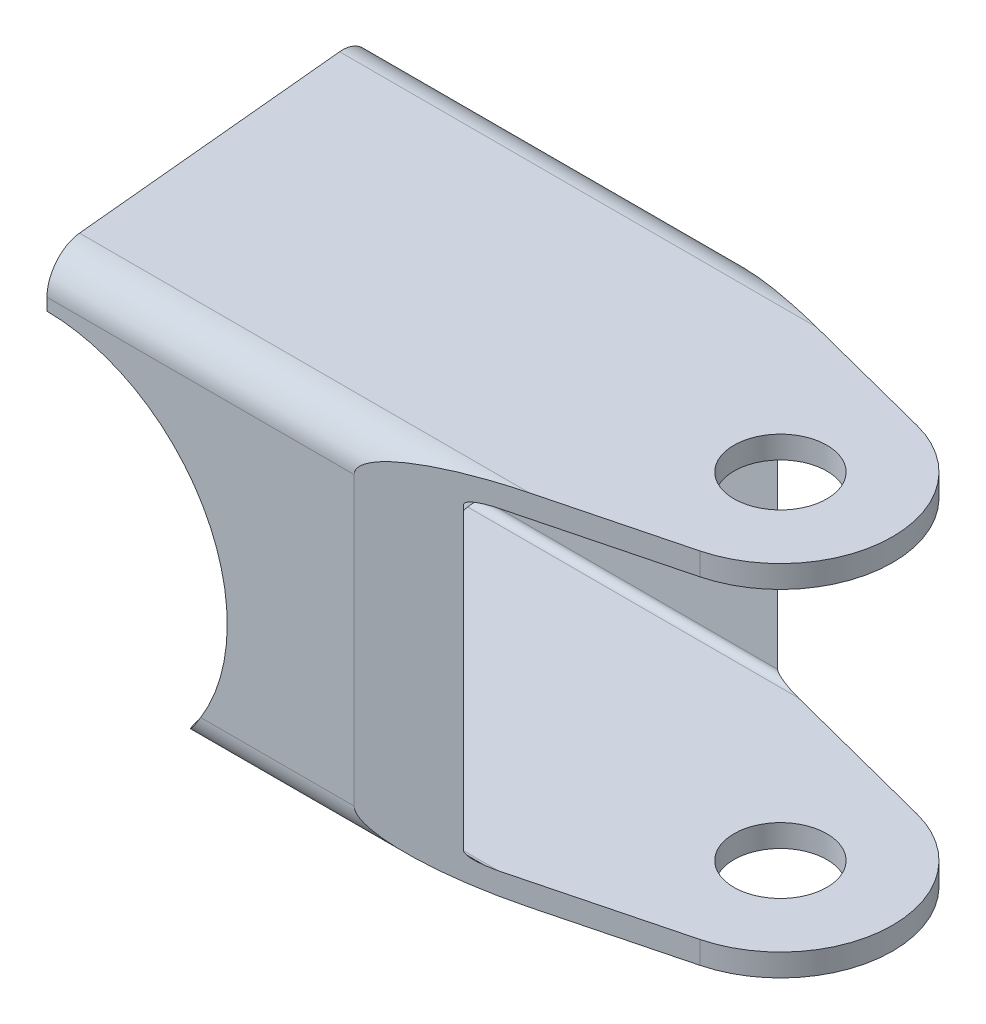
from build123d import *

# Parameters (mm, degrees)
BOSS_EXTRUDE1_DEPTH      = 25.4
BOSS_EXTRUDE1_DEPTH_BACK = 34.925
CUT_EXTRUDE4_DEPTH       = 63.941922635
CUT_EXTRUDE5_DEPTH       = 46.01339384
SKETCH14_R               = 3.2893
CUT_EXTRUDE6_DEPTH       = 46.01339384
CUT_EXTRUDE7_DEPTH       = 56.927898629
CUT_EXTRUDE7_DEPTH_BACK  = 56.927898629
SKETCH15_R               = 12.7
SKETCH17_W               = 59.080455772
SKETCH17_H               = 55.148842709
CUT_EXTRUDE8_DEPTH       = 52.94853237


with BuildPart() as part:
    # Sketch1 → Boss-Extrude1 (new, two sides: drawn at the far end of the back side and taken through both)
    with BuildSketch(Plane(origin=(0, 0, 0), x_dir=(0, 0, -1), z_dir=(1, 0, 0)).offset(-BOSS_EXTRUDE1_DEPTH_BACK)):
        with BuildLine():
            Line((-10.16, 12.7), (10.16, 12.7))
            ThreePointArc((10.16, 12.7), (11.956051224, 11.956051224), (12.7, 10.16))
            Line((12.7, 10.16), (12.7, -10.16))
            ThreePointArc((12.7, -10.16), (11.956051224, -11.956051224), (10.16, -12.7))
            Line((10.16, -12.7), (-10.16, -12.7))
            ThreePointArc((-10.16, -12.7), (-11.956051224, -11.956051224), (-12.7, -10.16))
            Line((-12.7, -10.16), (-12.7, 10.16))
            ThreePointArc((-12.7, 10.16), (-11.956051224, 11.956051224), (-10.16, 12.7))
        make_face()
    extrude(amount=BOSS_EXTRUDE1_DEPTH + BOSS_EXTRUDE1_DEPTH_BACK)

    # Sketch11 → Cut-Extrude4 (cut, through all)
    with BuildSketch(Plane(origin=(25.4, 0, 0), x_dir=(0, 0, -1), z_dir=(1, 0, 0))):
        with BuildLine():
            Line((-10.6045, 11.1125), (10.6045, 11.1125))
            ThreePointArc((10.6045, 11.1125), (10.963710245, 10.963710245), (11.1125, 10.6045))
            Line((11.1125, 10.6045), (11.1125, -10.6045))
            ThreePointArc((11.1125, -10.6045), (10.963710245, -10.963710245), (10.6045, -11.1125))
            Line((10.6045, -11.1125), (-10.6045, -11.1125))
            ThreePointArc((-10.6045, -11.1125), (-10.963710245, -10.963710245), (-11.1125, -10.6045))
            Line((-11.1125, -10.6045), (-11.1125, 10.6045))
            ThreePointArc((-11.1125, 10.6045), (-10.963710245, 10.963710245), (-10.6045, 11.1125))
        make_face()
    extrude(amount=-CUT_EXTRUDE4_DEPTH, mode=Mode.SUBTRACT)

    # Sketch12 → Cut-Extrude5 (cut, through all)
    with BuildSketch(Plane(origin=(0, 12.7, 0), x_dir=(1, 0, 0), z_dir=(0, 1, 0))):
        with BuildLine():
            Line((50.8, 12.7), (0, 12.7))
            Line((0, 12.7), (19.444424463, 7.686083637))
            ThreePointArc((19.444424463, 7.686083637), (25.4, 0), (19.444424463, -7.686083637))
            Line((19.444424463, -7.686083637), (0, -12.7))
            Line((0, -12.7), (50.8, -12.7))
            Line((50.8, -12.7), (50.8, 12.7))
        make_face()
    extrude(amount=-CUT_EXTRUDE5_DEPTH, mode=Mode.SUBTRACT)

    # Sketch14 → Cut-Extrude6 (cut, through all)
    with BuildSketch(Plane(origin=(0, 12.7, 0), x_dir=(1, 0, 0), z_dir=(0, 1, 0))):
        with Locations((17.4625, 0)):
            Circle(SKETCH14_R)
    extrude(amount=-CUT_EXTRUDE6_DEPTH, mode=Mode.SUBTRACT)

    # Sketch15 → Cut-Extrude7 (cut, two sides: drawn at the far end of the back side and taken through both)
    with BuildSketch(Plane(origin=(-21.74366369, -3.432105223, 12.7), x_dir=(-0.9956294808615993, -0.006900458495911936, 0.09313603229582201), z_dir=(-0.09339131029845446, 0.07356465915336342, -0.9929080038374085)).offset(-CUT_EXTRUDE7_DEPTH_BACK)):
        Circle(SKETCH15_R)
    extrude(amount=CUT_EXTRUDE7_DEPTH + CUT_EXTRUDE7_DEPTH_BACK, mode=Mode.SUBTRACT)

    # Sketch17 → Cut-Extrude8 (cut, through all)
    with BuildSketch(Plane(origin=(-22.73705084, 0, 2.138609984), x_dir=(-0.09339131029845445, 0.07356465915336355, -0.9929080038374085), z_dir=(0.9956056474877124, 0, -0.09364504626819836))):
        with Locations((0.199202034, -0.945767637)):
            Rectangle(SKETCH17_W, SKETCH17_H)
    extrude(amount=-CUT_EXTRUDE8_DEPTH, mode=Mode.SUBTRACT)


solid = part.part
